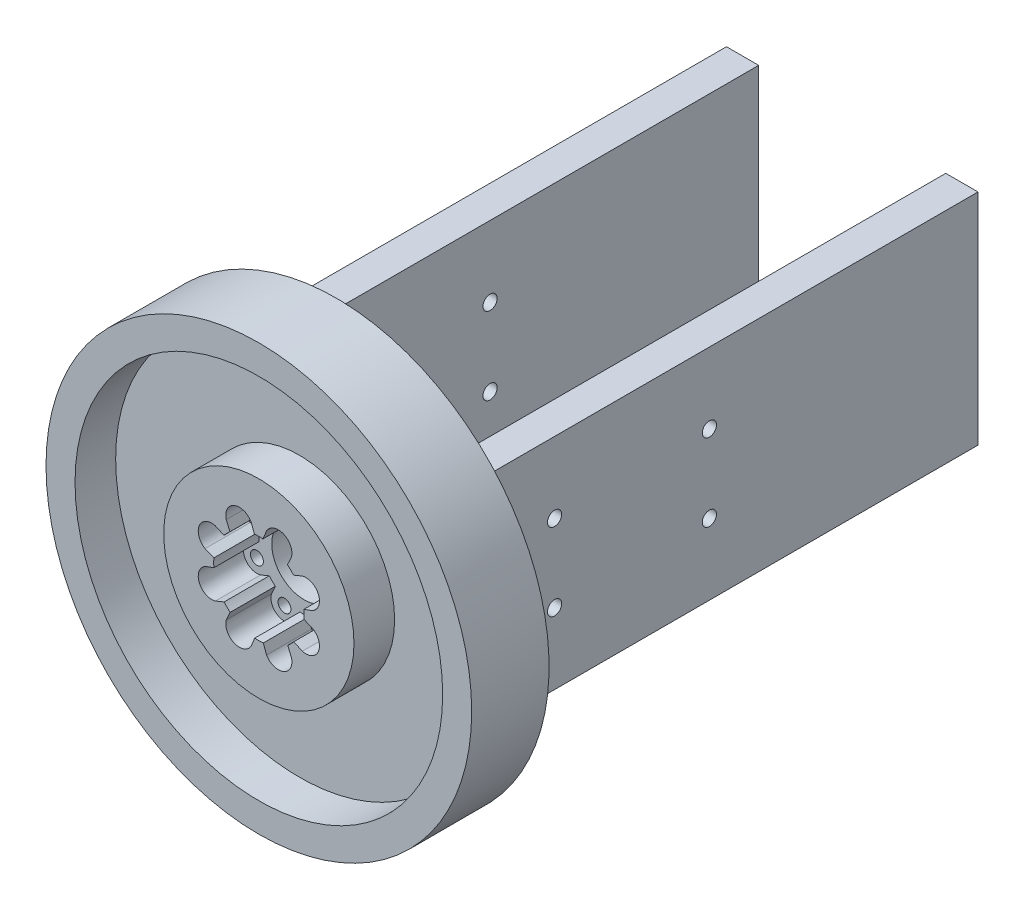
from build123d import *

# Parameters (mm, degrees)
CROQUIS1_R              = 33
SALIENTE_EXTRUIR3_DEPTH = 10
CROQUIS6_R              = 1.5
CORTAR_EXTRUIR4_DEPTH   = 2
SALIENTE_EXTRUIR5_START = 2
CROQUIS7_R              = 33
CROQUIS7_R_2            = 11
CROQUIS7_R_3            = 1.5
SALIENTE_EXTRUIR5_DEPTH = 2
CROQUIS8_W              = 5
CROQUIS8_H              = 34
SALIENTE_EXTRUIR6_DEPTH = 80
REDONDEO1_R             = 3
CORTAR_EXTRUIR5_REACH   = 104.807
CROQUIS9_R              = 1.1
SALIENTE_EXTRUIR7_START = 7.1
CROQUIS10_W             = 29
CROQUIS10_H             = 34
CROQUIS10_R             = 11
SALIENTE_EXTRUIR7_DEPTH = 7.1
REDONDEO2_R             = 3
CROQUIS12_R             = 1.100168331
CORTAR_EXTRUIR6_DEPTH   = 10
CROQUIS13_R             = 28.5
CROQUIS13_R_2           = 14.75
CORTAR_EXTRUIR7_DEPTH   = 6.3
CROQUIS16_W             = 10
CROQUIS16_H             = 10.202041029
CORTAR_EXTRUIR11_DEPTH  = 4
CORTAR_EXTRUIR15_DEPTH  = 7
CORTAR_EXTRUIR16_REACH  = 98.969
CROQUIS20_R             = 1
CORTAR_EXTRUIR17_REACH  = 98.969
CROQUIS21_R             = 5


with BuildPart() as part:
    # Croquis1 → Saliente-Extruir3 (new body)
    with BuildSketch(Plane.XY):
        Circle(CROQUIS1_R)
    extrude(amount=SALIENTE_EXTRUIR3_DEPTH)

    # Croquis6 → Cortar-Extruir4 (cut)
    with BuildSketch(Plane(origin=(0, 0, 0), x_dir=(-1, 0, 0), z_dir=(0, 0, -1))):
        with Locations((0, 28)):
            Circle(CROQUIS6_R)
        with Locations((24.248711306, 14)):
            Circle(CROQUIS6_R)
        with Locations((24.248711306, -14)):
            Circle(CROQUIS6_R)
        with Locations((0, -28)):
            Circle(CROQUIS6_R)
        with Locations((-24.248711306, -14)):
            Circle(CROQUIS6_R)
        with Locations((-24.248711306, 14)):
            Circle(CROQUIS6_R)
    extrude(amount=-CORTAR_EXTRUIR4_DEPTH, mode=Mode.SUBTRACT)

    # Croquis7 → Saliente-Extruir5 (add)
    with BuildSketch(Plane(origin=(0, 0, 0), x_dir=(-1, 0, 0), z_dir=(0, 0, -1)).offset(SALIENTE_EXTRUIR5_START)):
        Circle(CROQUIS7_R)
        Circle(CROQUIS7_R_2, mode=Mode.SUBTRACT)
        with Locations((24.248711306, -14)):
            Circle(CROQUIS7_R_3, mode=Mode.SUBTRACT)
        with Locations((0, -28)):
            Circle(CROQUIS7_R_3, mode=Mode.SUBTRACT)
        with Locations((-24.248711306, -14)):
            Circle(CROQUIS7_R_3, mode=Mode.SUBTRACT)
        with Locations((24.248711306, 14)):
            Circle(CROQUIS7_R_3, mode=Mode.SUBTRACT)
        with Locations((0, 28)):
            Circle(CROQUIS7_R_3, mode=Mode.SUBTRACT)
        with Locations((-24.248711306, 14)):
            Circle(CROQUIS7_R_3, mode=Mode.SUBTRACT)
    extrude(amount=-SALIENTE_EXTRUIR5_DEPTH)

    # Croquis8 → Saliente-Extruir6 (add)
    with BuildSketch(Plane(origin=(0, 0, -2), x_dir=(-1, 0, 0), z_dir=(0, 0, -1))):
        with Locations((-17, 0)):
            Rectangle(CROQUIS8_W, CROQUIS8_H)
        with Locations((17, 0)):
            Rectangle(CROQUIS8_W, CROQUIS8_H)
    extrude(amount=SALIENTE_EXTRUIR6_DEPTH)

    # Redondeo1
    redondeo1_edges = [part.edges().sort_by_distance(p)[0] for p in [
        (17, -17, -2),
        (17, 17, -2),
        (-17, -17, -2),
        (-17, 17, -2),
    ]]
    fillet(redondeo1_edges, radius=REDONDEO1_R)

    # Cortar-Extruir5: up to this face of the body (flat: up to its plane)
    cortar_extruir5_end = Plane(part.part.faces().sort_by_distance((19.5, 0, -41.944224496))[0])
    # Croquis9 → Cortar-Extruir5 (cut, up to the picked face)
    with BuildSketch(Plane.ZY.offset(19.5), mode=Mode.PRIVATE) as cortar_extruir5_sk1:
        with Locations((-16.35, 6)):
            Circle(CROQUIS9_R)
    cortar_extruir5_tool1 = split(extrude(cortar_extruir5_sk1.sketch, amount=-CORTAR_EXTRUIR5_REACH, mode=Mode.PRIVATE), bisect_by=cortar_extruir5_end, keep=Keep.BOTH, mode=Mode.PRIVATE)
    # Croquis9 → Cortar-Extruir5 (cut, up to the picked face)
    with BuildSketch(Plane.ZY.offset(19.5), mode=Mode.PRIVATE) as cortar_extruir5_sk2:
        with Locations((-16.35, -6)):
            Circle(CROQUIS9_R)
    cortar_extruir5_tool2 = split(extrude(cortar_extruir5_sk2.sketch, amount=-CORTAR_EXTRUIR5_REACH, mode=Mode.PRIVATE), bisect_by=cortar_extruir5_end, keep=Keep.BOTH, mode=Mode.PRIVATE)
    # Croquis9 → Cortar-Extruir5 (cut, up to the picked face)
    with BuildSketch(Plane.ZY.offset(19.5), mode=Mode.PRIVATE) as cortar_extruir5_sk3:
        with Locations((-40.35, 6)):
            Circle(CROQUIS9_R)
    cortar_extruir5_tool3 = split(extrude(cortar_extruir5_sk3.sketch, amount=-CORTAR_EXTRUIR5_REACH, mode=Mode.PRIVATE), bisect_by=cortar_extruir5_end, keep=Keep.BOTH, mode=Mode.PRIVATE)
    # Croquis9 → Cortar-Extruir5 (cut, up to the picked face)
    with BuildSketch(Plane.ZY.offset(19.5), mode=Mode.PRIVATE) as cortar_extruir5_sk4:
        with Locations((-40.35, -6)):
            Circle(CROQUIS9_R)
    cortar_extruir5_tool4 = split(extrude(cortar_extruir5_sk4.sketch, amount=-CORTAR_EXTRUIR5_REACH, mode=Mode.PRIVATE), bisect_by=cortar_extruir5_end, keep=Keep.BOTH, mode=Mode.PRIVATE)
    add(cortar_extruir5_tool1.solids().sort_by(Axis((-19.5, 6, -16.35), (1, 0, 0)))[0], mode=Mode.SUBTRACT)
    add(cortar_extruir5_tool2.solids().sort_by(Axis((-19.5, -6, -16.35), (1, 0, 0)))[0], mode=Mode.SUBTRACT)
    add(cortar_extruir5_tool3.solids().sort_by(Axis((-19.5, 6, -40.35), (1, 0, 0)))[0], mode=Mode.SUBTRACT)
    add(cortar_extruir5_tool4.solids().sort_by(Axis((-19.5, -6, -40.35), (1, 0, 0)))[0], mode=Mode.SUBTRACT)

    # Croquis10 → Saliente-Extruir7 (add)
    with BuildSketch(Plane(origin=(0, 0, -2), x_dir=(-1, 0, 0), z_dir=(0, 0, -1)).offset(SALIENTE_EXTRUIR7_START)):
        Rectangle(CROQUIS10_W, CROQUIS10_H)
        Circle(CROQUIS10_R, mode=Mode.SUBTRACT)
    extrude(amount=-SALIENTE_EXTRUIR7_DEPTH)

    # Redondeo2
    redondeo2_edges = [part.edges().sort_by_distance(p)[0] for p in [
        (0, 17, -2),
        (0, -17, -2),
    ]]
    fillet(redondeo2_edges, radius=REDONDEO2_R)

    # Croquis12 → Cortar-Extruir6 (cut)
    with BuildSketch(Plane(origin=(0, 0, -82), x_dir=(-1, 0, 0), z_dir=(0, 0, -1))):
        with Locations((-17, 14.5)):
            Circle(CROQUIS12_R)
        with Locations((-17, -14.5)):
            Circle(CROQUIS12_R)
        with Locations((17, -14.5)):
            Circle(CROQUIS12_R)
        with Locations((17, 14.5)):
            Circle(CROQUIS12_R)
    extrude(amount=-CORTAR_EXTRUIR6_DEPTH, mode=Mode.SUBTRACT)

    # Croquis13 → Cortar-Extruir7 (cut)
    with BuildSketch(Plane.XY.offset(10)):
        Circle(CROQUIS13_R)
        Circle(CROQUIS13_R_2, mode=Mode.SUBTRACT)
    extrude(amount=-CORTAR_EXTRUIR7_DEPTH, mode=Mode.SUBTRACT)

    # Croquis16 → Cortar-Extruir11 (cut)
    with BuildSketch(Plane(origin=(0, 0, -9.1), x_dir=(-1, 0, 0), z_dir=(0, 0, -1))):
        with Locations((0, -14.898979485)):
            Rectangle(CROQUIS16_W, CROQUIS16_H)
    extrude(amount=-CORTAR_EXTRUIR11_DEPTH, mode=Mode.SUBTRACT)

    # Croquis19 → Cortar-Extruir15 (cut)
    with BuildSketch(Plane.XY.offset(10)):
        with BuildLine():
            Line((6.734006542, 5.045865593), (5.375868613, 4.483306443))
            ThreePointArc((5.375868613, 4.483306443), (4.929415402, 4.969996358), (4.439081587, 5.412444426))
            Line((4.439081587, 5.412444426), (5.048089145, 6.742033206))
            ThreePointArc((5.048089145, 6.742033206), (3.822985267, 9.240385187), (1.193695913, 8.329627468))
            Line((1.193695913, 8.329627468), (0.631136763, 6.971489539))
            ThreePointArc((0.631136763, 6.971489539), (-0.028695069, 6.999941185), (-0.688271463, 6.966080849))
            Line((-0.688271463, 6.966080849), (-1.197799333, 8.336875465))
            ThreePointArc((-1.197799333, 8.336875465), (-3.83068022, 9.237197833), (-5.045865593, 6.734006542))
            Line((-5.045865593, 6.734006542), (-4.483306443, 5.375868613))
            ThreePointArc((-4.483306443, 5.375868613), (-4.969996358, 4.929415402), (-5.412444426, 4.439081587))
            Line((-5.412444426, 4.439081587), (-6.742033206, 5.048089145))
            ThreePointArc((-6.742033206, 5.048089145), (-9.240385187, 3.822985267), (-8.329627468, 1.193695913))
            Line((-8.329627468, 1.193695913), (-6.971489539, 0.631136763))
            ThreePointArc((-6.971489539, 0.631136763), (-6.999941185, -0.028695069), (-6.966080849, -0.688271463))
            Line((-6.966080849, -0.688271463), (-8.336875465, -1.197799333))
            ThreePointArc((-8.336875465, -1.197799333), (-9.237197833, -3.83068022), (-6.734006542, -5.045865593))
            Line((-6.734006542, -5.045865593), (-5.375868613, -4.483306443))
            ThreePointArc((-5.375868613, -4.483306443), (-4.929415402, -4.969996358), (-4.439081587, -5.412444426))
            Line((-4.439081587, -5.412444426), (-5.048089145, -6.742033206))
            ThreePointArc((-5.048089145, -6.742033206), (-3.822985267, -9.240385187), (-1.193695913, -8.329627468))
            Line((-1.193695913, -8.329627468), (-0.631136763, -6.971489539))
            ThreePointArc((-0.631136763, -6.971489539), (0.028695069, -6.999941185), (0.688271463, -6.966080849))
            Line((0.688271463, -6.966080849), (1.197799333, -8.336875465))
            ThreePointArc((1.197799333, -8.336875465), (3.83068022, -9.237197833), (5.045865593, -6.734006542))
            Line((5.045865593, -6.734006542), (4.483306443, -5.375868613))
            ThreePointArc((4.483306443, -5.375868613), (4.969996358, -4.929415402), (5.412444426, -4.439081587))
            Line((5.412444426, -4.439081587), (6.742033206, -5.048089145))
            ThreePointArc((6.742033206, -5.048089145), (9.240385187, -3.822985267), (8.329627468, -1.193695913))
            Line((8.329627468, -1.193695913), (6.971489539, -0.631136763))
            ThreePointArc((6.971489539, -0.631136763), (6.999941185, 0.028695069), (6.966080849, 0.688271463))
            Line((6.966080849, 0.688271463), (8.336875465, 1.197799333))
            ThreePointArc((8.336875465, 1.197799333), (9.237197833, 3.83068022), (6.734006542, 5.045865593))
        make_face()
    extrude(amount=-CORTAR_EXTRUIR15_DEPTH, mode=Mode.SUBTRACT)

    # Croquis20 → Cortar-Extruir16 (cut, up to next)
    with BuildSketch(Plane.XY.offset(3), mode=Mode.PRIVATE) as cortar_extruir16_sk1:
        with Locations((-7.298648307, 3.023199116)):
            Circle(CROQUIS20_R)
    cortar_extruir16_tool1 = extrude(cortar_extruir16_sk1.sketch, amount=-CORTAR_EXTRUIR16_REACH, mode=Mode.PRIVATE) & part.part
    # Croquis20 → Cortar-Extruir16 (cut, up to next)
    with BuildSketch(Plane.XY.offset(3), mode=Mode.PRIVATE) as cortar_extruir16_sk2:
        with Locations((-7.298648307, -3.023199116)):
            Circle(CROQUIS20_R)
    cortar_extruir16_tool2 = extrude(cortar_extruir16_sk2.sketch, amount=-CORTAR_EXTRUIR16_REACH, mode=Mode.PRIVATE) & part.part
    # Croquis20 → Cortar-Extruir16 (cut, up to next)
    with BuildSketch(Plane.XY.offset(3), mode=Mode.PRIVATE) as cortar_extruir16_sk3:
        with Locations((-3.023199116, -7.298648307)):
            Circle(CROQUIS20_R)
    cortar_extruir16_tool3 = extrude(cortar_extruir16_sk3.sketch, amount=-CORTAR_EXTRUIR16_REACH, mode=Mode.PRIVATE) & part.part
    # Croquis20 → Cortar-Extruir16 (cut, up to next)
    with BuildSketch(Plane.XY.offset(3), mode=Mode.PRIVATE) as cortar_extruir16_sk4:
        with Locations((3.023199116, -7.298648307)):
            Circle(CROQUIS20_R)
    cortar_extruir16_tool4 = extrude(cortar_extruir16_sk4.sketch, amount=-CORTAR_EXTRUIR16_REACH, mode=Mode.PRIVATE) & part.part
    # Croquis20 → Cortar-Extruir16 (cut, up to next)
    with BuildSketch(Plane.XY.offset(3), mode=Mode.PRIVATE) as cortar_extruir16_sk5:
        with Locations((7.298648307, -3.023199116)):
            Circle(CROQUIS20_R)
    cortar_extruir16_tool5 = extrude(cortar_extruir16_sk5.sketch, amount=-CORTAR_EXTRUIR16_REACH, mode=Mode.PRIVATE) & part.part
    # Croquis20 → Cortar-Extruir16 (cut, up to next)
    with BuildSketch(Plane.XY.offset(3), mode=Mode.PRIVATE) as cortar_extruir16_sk6:
        with Locations((7.298648307, 3.023199116)):
            Circle(CROQUIS20_R)
    cortar_extruir16_tool6 = extrude(cortar_extruir16_sk6.sketch, amount=-CORTAR_EXTRUIR16_REACH, mode=Mode.PRIVATE) & part.part
    # Croquis20 → Cortar-Extruir16 (cut, up to next)
    with BuildSketch(Plane.XY.offset(3), mode=Mode.PRIVATE) as cortar_extruir16_sk7:
        with Locations((3.023199116, 7.298648307)):
            Circle(CROQUIS20_R)
    cortar_extruir16_tool7 = extrude(cortar_extruir16_sk7.sketch, amount=-CORTAR_EXTRUIR16_REACH, mode=Mode.PRIVATE) & part.part
    # Croquis20 → Cortar-Extruir16 (cut, up to next)
    with BuildSketch(Plane.XY.offset(3), mode=Mode.PRIVATE) as cortar_extruir16_sk8:
        with Locations((-3.023199116, 7.298648307)):
            Circle(CROQUIS20_R)
    cortar_extruir16_tool8 = extrude(cortar_extruir16_sk8.sketch, amount=-CORTAR_EXTRUIR16_REACH, mode=Mode.PRIVATE) & part.part
    add(cortar_extruir16_tool1.solids().sort_by_distance((-7.298648, 3.023199, 3))[0], mode=Mode.SUBTRACT)
    add(cortar_extruir16_tool2.solids().sort_by_distance((-7.298648, -3.023199, 3))[0], mode=Mode.SUBTRACT)
    add(cortar_extruir16_tool3.solids().sort_by_distance((-3.023199, -7.298648, 3))[0], mode=Mode.SUBTRACT)
    add(cortar_extruir16_tool4.solids().sort_by_distance((3.023199, -7.298648, 3))[0], mode=Mode.SUBTRACT)
    add(cortar_extruir16_tool5.solids().sort_by_distance((7.298648, -3.023199, 3))[0], mode=Mode.SUBTRACT)
    add(cortar_extruir16_tool6.solids().sort_by_distance((7.298648, 3.023199, 3))[0], mode=Mode.SUBTRACT)
    add(cortar_extruir16_tool7.solids().sort_by_distance((3.023199, 7.298648, 3))[0], mode=Mode.SUBTRACT)
    add(cortar_extruir16_tool8.solids().sort_by_distance((-3.023199, 7.298648, 3))[0], mode=Mode.SUBTRACT)

    # Croquis21 → Cortar-Extruir17 (cut, up to next)
    with BuildSketch(Plane.XY.offset(3), mode=Mode.PRIVATE) as cortar_extruir17_sk1:
        Circle(CROQUIS21_R)
    cortar_extruir17_tool1 = extrude(cortar_extruir17_sk1.sketch, amount=-CORTAR_EXTRUIR17_REACH, mode=Mode.PRIVATE) & part.part
    add(cortar_extruir17_tool1.solids().sort_by_distance((0, 0, 3))[0], mode=Mode.SUBTRACT)


solid = part.part
